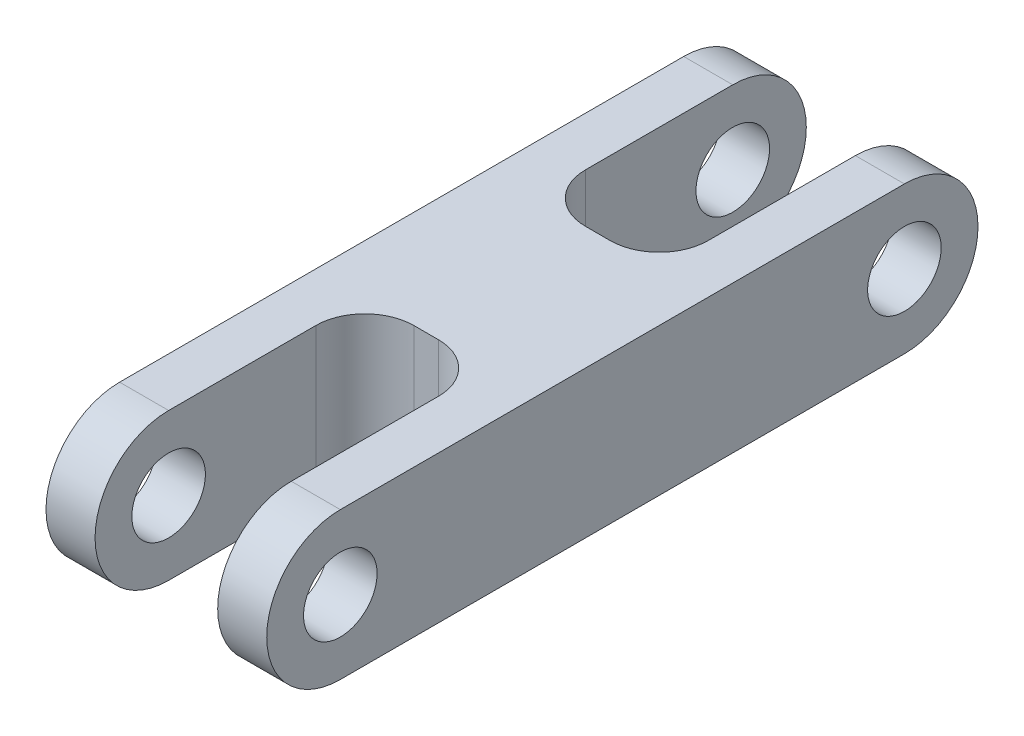
from build123d import *

# Parameters (mm, degrees)
SKETCH1_R           = 1.5
BOSS_EXTRUDE1_DEPTH = 2
SKETCH2_W           = 7
SKETCH2_H           = 6
BOSS_EXTRUDE2_DEPTH = 5
SKETCH3_R           = 1.5
BOSS_EXTRUDE3_DEPTH = 2
FILLET1_R           = 2


with BuildPart() as part:
    # Sketch1 → Boss-Extrude1 (new body)
    with BuildSketch(Plane(origin=(0, 0, 0), x_dir=(0, 0, -1), z_dir=(1, 0, 0))):
        with BuildLine():
            Line((-11.5, 3), (11.5, 3))
            ThreePointArc((11.5, 3), (14.5, 0), (11.5, -3))
            Line((11.5, -3), (-11.5, -3))
            ThreePointArc((-11.5, -3), (-14.5, 0), (-11.5, 3))
        make_face()
        with Locations((-11.5, 0)):
            Circle(SKETCH1_R, mode=Mode.SUBTRACT)
        with Locations((11.5, 0)):
            Circle(SKETCH1_R, mode=Mode.SUBTRACT)
    extrude(amount=BOSS_EXTRUDE1_DEPTH)

    # Sketch2 → Boss-Extrude2 (add)
    with BuildSketch(Plane(origin=(2, 0, 0), x_dir=(0, 0, -1), z_dir=(1, 0, 0))):
        Rectangle(SKETCH2_W, SKETCH2_H)
    extrude(amount=BOSS_EXTRUDE2_DEPTH)

    # Sketch3 → Boss-Extrude3 (add)
    with BuildSketch(Plane(origin=(7, 0, 0), x_dir=(0, 0, -1), z_dir=(1, 0, 0))):
        with BuildLine():
            Line((11.5, 3), (-11.5, 3))
            ThreePointArc((-11.5, 3), (-14.5, 0), (-11.5, -3))
            Line((-11.5, -3), (11.5, -3))
            ThreePointArc((11.5, -3), (14.5, 0), (11.5, 3))
        make_face()
        with Locations((11.5, 0)):
            Circle(SKETCH3_R, mode=Mode.SUBTRACT)
        with Locations((-11.5, 0)):
            Circle(SKETCH3_R, mode=Mode.SUBTRACT)
    extrude(amount=BOSS_EXTRUDE3_DEPTH)

    # Fillet1
    fillet1_edges = [part.edges().sort_by_distance(p)[0] for p in [
        (2, 0, -3.5),
        (2, 0, 3.5),
        (7, 0, -3.5),
        (7, 0, 3.5),
    ]]
    fillet(fillet1_edges, radius=FILLET1_R)


solid = part.part
